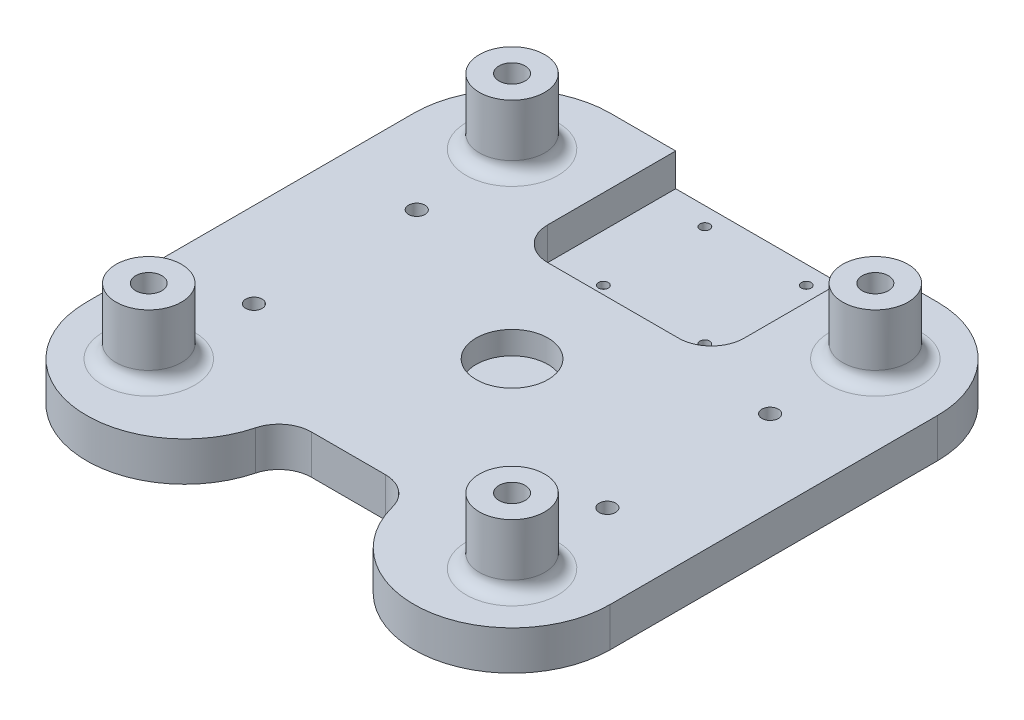
from build123d import *

# Parameters (mm, degrees)
BOSS_EXTRUDE6_DEPTH = 12
FILLET4_R           = 10
SKETCH13_R          = 4
CUT_EXTRUDE5_DEPTH  = 114.771701227
SKETCH14_R          = 10
BOSS_EXTRUDE7_DEPTH = 20
SKETCH15_R          = 4
CUT_EXTRUDE6_DEPTH  = 115.891252931
FILLET5_R           = 4
SKETCH16_R          = 11
CUT_EXTRUDE7_DEPTH  = 7
SKETCH17_R          = 1.5
CUT_EXTRUDE8_DEPTH  = 115.891252931
SKETCH18_W          = 60
SKETCH18_H          = 70
CUT_EXTRUDE9_DEPTH  = 10
FILLET6_R           = 10
SKETCH19_R          = 2.5
CUT_EXTRUDE10_DEPTH = 115.891252931


with BuildPart() as part:
    # Sketch12 → Boss-Extrude6 (new body)
    with BuildSketch(Plane(origin=(0, 0, 0), x_dir=(1, 0, 0), z_dir=(0, 1, 0))):
        with BuildLine():
            Line((-20, -50), (20, -50))
            ThreePointArc((20, -50), (28.786796564, -71.213203436), (50, -80))
            ThreePointArc((50, -80), (71.213203436, -71.213203436), (80, -50))
            Line((80, -50), (80, 50))
            ThreePointArc((80, 50), (71.213203436, 71.213203436), (50, 80))
            Line((50, 80), (-50, 80))
            ThreePointArc((-50, 80), (-71.213203436, 71.213203436), (-80, 50))
            Line((-80, 50), (-80, -50))
            ThreePointArc((-80, -50), (-71.213203436, -71.213203436), (-50, -80))
            ThreePointArc((-50, -80), (-28.786796564, -71.213203436), (-20, -50))
        make_face()
    extrude(amount=BOSS_EXTRUDE6_DEPTH)

    # Fillet4
    fillet4_edges = [part.edges().sort_by_distance(p)[0] for p in [
        (20, 6, 50),
        (-20, 6, 50),
    ]]
    fillet(fillet4_edges, radius=FILLET4_R)

    # Sketch13 → Cut-Extrude5 (cut, through all)
    with BuildSketch(Plane(origin=(0, 12, 0), x_dir=(1, 0, 0), z_dir=(0, 1, 0))):
        with Locations(Location((-55.5, 55.5, 0), (0, 0, 270))):
            Circle(SKETCH13_R)
        with Locations(Location((55.5, 55.5, 0), (0, 0, 270))):
            Circle(SKETCH13_R)
        with Locations(Location((-55.5, -55.5, 0), (0, 0, 270))):
            Circle(SKETCH13_R)
        with Locations(Location((55.5, -55.5, 0), (0, 0, 270))):
            Circle(SKETCH13_R)
    extrude(amount=-CUT_EXTRUDE5_DEPTH, mode=Mode.SUBTRACT)

    # Sketch14 → Boss-Extrude7 (add)
    with BuildSketch(Plane(origin=(0, 12, 0), x_dir=(1, 0, 0), z_dir=(0, 1, 0))):
        with Locations(Location((-55.5, 55.5, 0), (0, 0, 90))):
            Circle(SKETCH14_R)
        with Locations(Location((55.5, 55.5, 0), (0, 0, 90))):
            Circle(SKETCH14_R)
        with Locations(Location((-55.5, -55.5, 0), (0, 0, 90))):
            Circle(SKETCH14_R)
        with Locations(Location((55.5, -55.5, 0), (0, 0, 90))):
            Circle(SKETCH14_R)
    extrude(amount=BOSS_EXTRUDE7_DEPTH)

    # Sketch15 → Cut-Extrude6 (cut, through all)
    with BuildSketch(Plane.XZ.offset(-12)):
        with Locations(Location((-55.5, -55.5, 0), (0, 0, 90))):
            Circle(SKETCH15_R)
        with Locations(Location((-55.5, 55.5, 0), (0, 0, 90))):
            Circle(SKETCH15_R)
        with Locations(Location((55.5, 55.5, 0), (0, 0, 90))):
            Circle(SKETCH15_R)
        with Locations(Location((55.5, -55.5, 0), (0, 0, 90))):
            Circle(SKETCH15_R)
    extrude(amount=-CUT_EXTRUDE6_DEPTH, mode=Mode.SUBTRACT)

    # Fillet5
    fillet5_edges = [part.edges().sort_by_distance(p)[0] for p in [
        (-55.5, 12, -45.5),
        (-55.5, 12, 65.5),
        (55.5, 12, 65.5),
        (55.5, 12, -45.5),
    ]]
    fillet(fillet5_edges, radius=FILLET5_R)

    # Sketch16 → Cut-Extrude7 (cut)
    with BuildSketch(Plane(origin=(0, 12, 0), x_dir=(1, 0, 0), z_dir=(0, 1, 0))):
        with Locations(Location((0, 0, 0), (0, 0, 270))):
            Circle(SKETCH16_R)
    extrude(amount=-CUT_EXTRUDE7_DEPTH, mode=Mode.SUBTRACT)

    # Sketch17 → Cut-Extrude8 (cut, through all)
    with BuildSketch(Plane(origin=(0, 12, 0), x_dir=(1, 0, 0), z_dir=(0, 1, 0))):
        with Locations(Location((-15.5, 74.4, 0), (0, 0, 270))):
            Circle(SKETCH17_R)
        with Locations(Location((15.5, 74.4, 0), (0, 0, 270))):
            Circle(SKETCH17_R)
        with Locations(Location((-15.5, 43.4, 0), (0, 0, 270))):
            Circle(SKETCH17_R)
        with Locations(Location((15.5, 43.4, 0), (0, 0, 270))):
            Circle(SKETCH17_R)
    extrude(amount=-CUT_EXTRUDE8_DEPTH, mode=Mode.SUBTRACT)

    # Sketch18 → Cut-Extrude9 (cut)
    with BuildSketch(Plane(origin=(0, 12, 0), x_dir=(1, 0, 0), z_dir=(0, 1, 0))):
        with Locations((0, 65.9)):
            Rectangle(SKETCH18_W, SKETCH18_H)
    extrude(amount=-CUT_EXTRUDE9_DEPTH, mode=Mode.SUBTRACT)

    # Fillet6
    fillet6_edges = [part.edges().sort_by_distance(p)[0] for p in [
        (-30, 7, -30.9),
        (30, 7, -30.9),
    ]]
    fillet(fillet6_edges, radius=FILLET6_R)

    # Sketch19 → Cut-Extrude10 (cut, through all)
    with BuildSketch(Plane(origin=(0, 12, 0), x_dir=(1, 0, 0), z_dir=(0, 1, 0))):
        with Locations(Location((-53.98995062, 24.867500749, 0), (0, 0, 270))):
            Circle(SKETCH19_R)
        with Locations(Location((-53.98995062, -24.867500749, 0), (0, 0, 270))):
            Circle(SKETCH19_R)
        with Locations(Location((53.98995062, 24.867500749, 0), (0, 0, 270))):
            Circle(SKETCH19_R)
        with Locations(Location((53.98995062, -24.867500749, 0), (0, 0, 270))):
            Circle(SKETCH19_R)
    extrude(amount=-CUT_EXTRUDE10_DEPTH, mode=Mode.SUBTRACT)


solid = part.part
